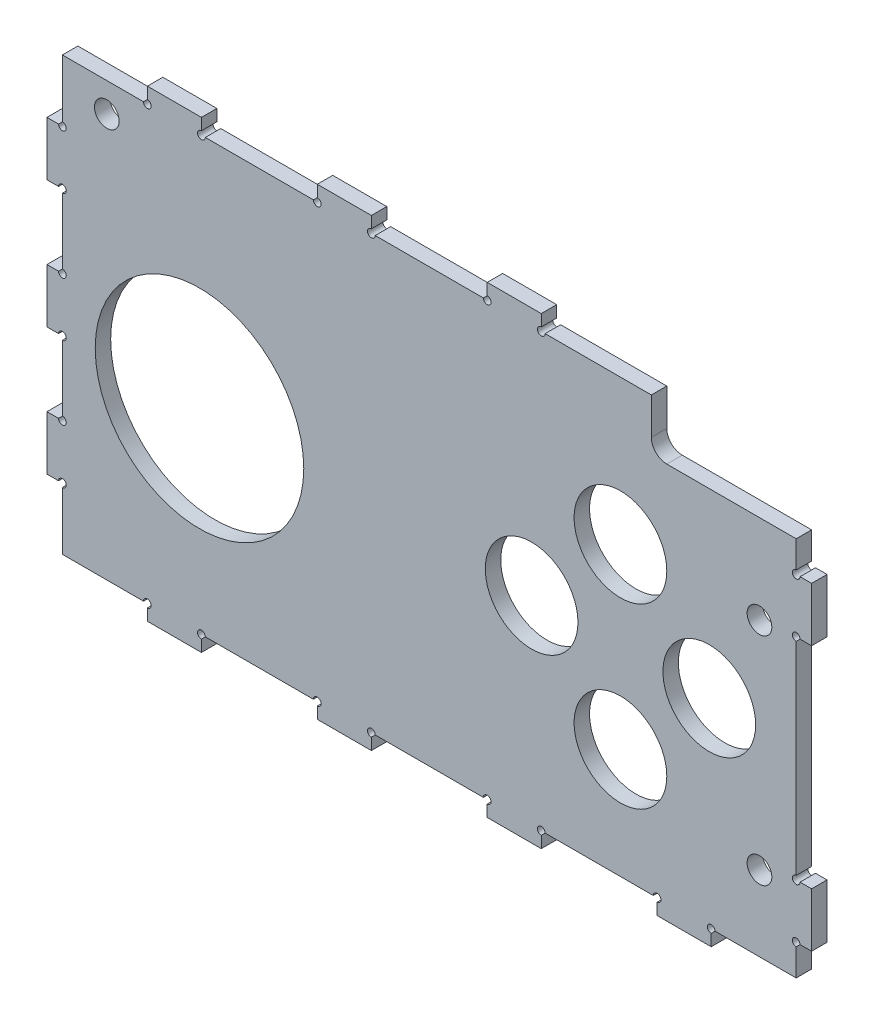
from build123d import *

# Parameters (mm, degrees)
SKETCH_5_W          = 95
SKETCH_5_H          = 56
EXTRUDE_1_DEPTH     = 2
SKETCH_3_R          = 6
CUT_EXTRUDE_2_DEPTH = 106.577578112
SKETCH_4_R          = 13.5
CUT_EXTRUDE_3_DEPTH = 106.577578112
SKETCH_6_W          = 20
SKETCH_6_H          = 9
CUT_EXTRUDE_4_DEPTH = 106.577578112
FILLET_2_R          = 2
SKETCH_8_R          = 1.6
CUT_EXTRUDE_6_DEPTH = 106.577578112
SKETCH_10_W         = 7
SKETCH_10_H         = 2
EXTRUDE_2_DEPTH     = 2
SKETCH_11_R         = 0.5
CUT_EXTRUDE_8_DEPTH = 107.628443672
SKETCH_12_W         = 2
SKETCH_12_H         = 7
EXTRUDE_3_DEPTH     = 2
SKETCH_13_W         = 2
SKETCH_13_H         = 7
EXTRUDE_4_DEPTH     = 2
SKETCH_14_R         = 0.5
CUT_EXTRUDE_9_DEPTH = 109.326474142


with BuildPart() as part:
    # 草图5 → 凸台-拉伸1 (new body)
    with BuildSketch(Plane.XY):
        with Locations((42.75, 26.75)):
            Rectangle(SKETCH_5_W, SKETCH_5_H)
    extrude(amount=EXTRUDE_1_DEPTH)

    # 草图3 → 切除-拉伸2 (cut, through all)
    with BuildSketch(Plane.XY):
        with Locations((67.5, 36)):
            Circle(SKETCH_3_R)
        with Locations((56, 24.5)):
            Circle(SKETCH_3_R)
        with Locations((67.5, 13)):
            Circle(SKETCH_3_R)
        with Locations((79, 24.5)):
            Circle(SKETCH_3_R)
    extrude(amount=CUT_EXTRUDE_2_DEPTH, mode=Mode.SUBTRACT)

    # 草图4 → 切除-拉伸3 (cut, through all)
    with BuildSketch(Plane.XY):
        with Locations((13, 24)):
            Circle(SKETCH_4_R)
    extrude(amount=CUT_EXTRUDE_3_DEPTH, mode=Mode.SUBTRACT)

    # 草图6 → 切除-拉伸4 (cut, through all)
    with BuildSketch(Plane.XY):
        with Locations((81.5, 52.5)):
            Rectangle(SKETCH_6_W, SKETCH_6_H)
    extrude(amount=CUT_EXTRUDE_4_DEPTH, mode=Mode.SUBTRACT)

    # 圆角2
    fillet_2_edges = [part.edges().sort_by_distance(p)[0] for p in [
        (71.5, 48, 1),
    ]]
    fillet(fillet_2_edges, radius=FILLET_2_R)

    # 草图8 → 切除-拉伸6 (cut, through all)
    with BuildSketch(Plane(origin=(0, 0, 0), x_dir=(-1, 0, 0), z_dir=(0, 0, -1))):
        with Locations((-85.5, 36.5)):
            Circle(SKETCH_8_R)
        with Locations((-85.5, 8.5)):
            Circle(SKETCH_8_R)
        with Locations((-1, 51)):
            Circle(SKETCH_8_R)
    extrude(amount=-CUT_EXTRUDE_6_DEPTH, mode=Mode.SUBTRACT)

    # 草图10 → 凸台-拉伸2 (add)
    with BuildSketch(Plane(origin=(0, 0, 0), x_dir=(-1, 0, 0), z_dir=(0, 0, -1))):
        with Locations((-9.75, 55.75)):
            Rectangle(SKETCH_10_W, SKETCH_10_H)
        with Locations((-31.75, 55.75)):
            Rectangle(SKETCH_10_W, SKETCH_10_H)
        with Locations((-53.75, 55.75)):
            Rectangle(SKETCH_10_W, SKETCH_10_H)
        with Locations((-75.75, -2.25)):
            Rectangle(SKETCH_10_W, SKETCH_10_H)
        with Locations((-53.75, -2.25)):
            Rectangle(SKETCH_10_W, SKETCH_10_H)
        with Locations((-31.75, -2.25)):
            Rectangle(SKETCH_10_W, SKETCH_10_H)
        with Locations((-9.75, -2.25)):
            Rectangle(SKETCH_10_W, SKETCH_10_H)
    extrude(amount=-EXTRUDE_2_DEPTH)

    # 草图11 → 切除-拉伸8 (cut, through all)
    with BuildSketch(Plane(origin=(0, 0, 0), x_dir=(-1, 0, 0), z_dir=(0, 0, -1))):
        with Locations((-57.25, 54.75)):
            Circle(SKETCH_11_R)
        with Locations((-50.25, 54.75)):
            Circle(SKETCH_11_R)
        with Locations((-35.25, 54.75)):
            Circle(SKETCH_11_R)
        with Locations((-28.25, 54.75)):
            Circle(SKETCH_11_R)
        with Locations((-13.25, 54.75)):
            Circle(SKETCH_11_R)
        with Locations((-6.25, 54.75)):
            Circle(SKETCH_11_R)
        with Locations((-79.25, -1.25)):
            Circle(SKETCH_11_R)
        with Locations((-72.25, -1.25)):
            Circle(SKETCH_11_R)
        with Locations((-57.25, -1.25)):
            Circle(SKETCH_11_R)
        with Locations((-50.25, -1.25)):
            Circle(SKETCH_11_R)
        with Locations((-35.25, -1.25)):
            Circle(SKETCH_11_R)
        with Locations((-28.25, -1.25)):
            Circle(SKETCH_11_R)
        with Locations((-13.25, -1.25)):
            Circle(SKETCH_11_R)
        with Locations((-6.25, -1.25)):
            Circle(SKETCH_11_R)
    extrude(amount=-CUT_EXTRUDE_8_DEPTH, mode=Mode.SUBTRACT)

    # 草图12 → 凸台-拉伸3 (add)
    with BuildSketch(Plane.XY.offset(2)):
        with Locations((91.25, 40.5)):
            Rectangle(SKETCH_12_W, SKETCH_12_H)
        with Locations((91.25, 6.25)):
            Rectangle(SKETCH_12_W, SKETCH_12_H)
    extrude(amount=-EXTRUDE_3_DEPTH)

    # 草图13 → 凸台-拉伸4 (add)
    with BuildSketch(Plane.XY.offset(2)):
        with Locations((-5.75, 10.25)):
            Rectangle(SKETCH_13_W, SKETCH_13_H)
        with Locations((-5.75, 26.75)):
            Rectangle(SKETCH_13_W, SKETCH_13_H)
        with Locations((-5.75, 43.25)):
            Rectangle(SKETCH_13_W, SKETCH_13_H)
    extrude(amount=-EXTRUDE_4_DEPTH)

    # 草图14 → 切除-拉伸9 (cut, through all)
    with BuildSketch(Plane.XY.offset(2)):
        with Locations((-4.75, 46.75)):
            Circle(SKETCH_14_R)
        with Locations((-4.75, 39.75)):
            Circle(SKETCH_14_R)
        with Locations((-4.75, 30.25)):
            Circle(SKETCH_14_R)
        with Locations((-4.75, 23.25)):
            Circle(SKETCH_14_R)
        with Locations((-4.75, 13.75)):
            Circle(SKETCH_14_R)
        with Locations((-4.75, 6.75)):
            Circle(SKETCH_14_R)
        with Locations((90.25, 44)):
            Circle(SKETCH_14_R)
        with Locations((90.25, 37)):
            Circle(SKETCH_14_R)
        with Locations((90.25, 9.75)):
            Circle(SKETCH_14_R)
        with Locations((90.25, 2.75)):
            Circle(SKETCH_14_R)
    extrude(amount=-CUT_EXTRUDE_9_DEPTH, mode=Mode.SUBTRACT)


solid = part.part
